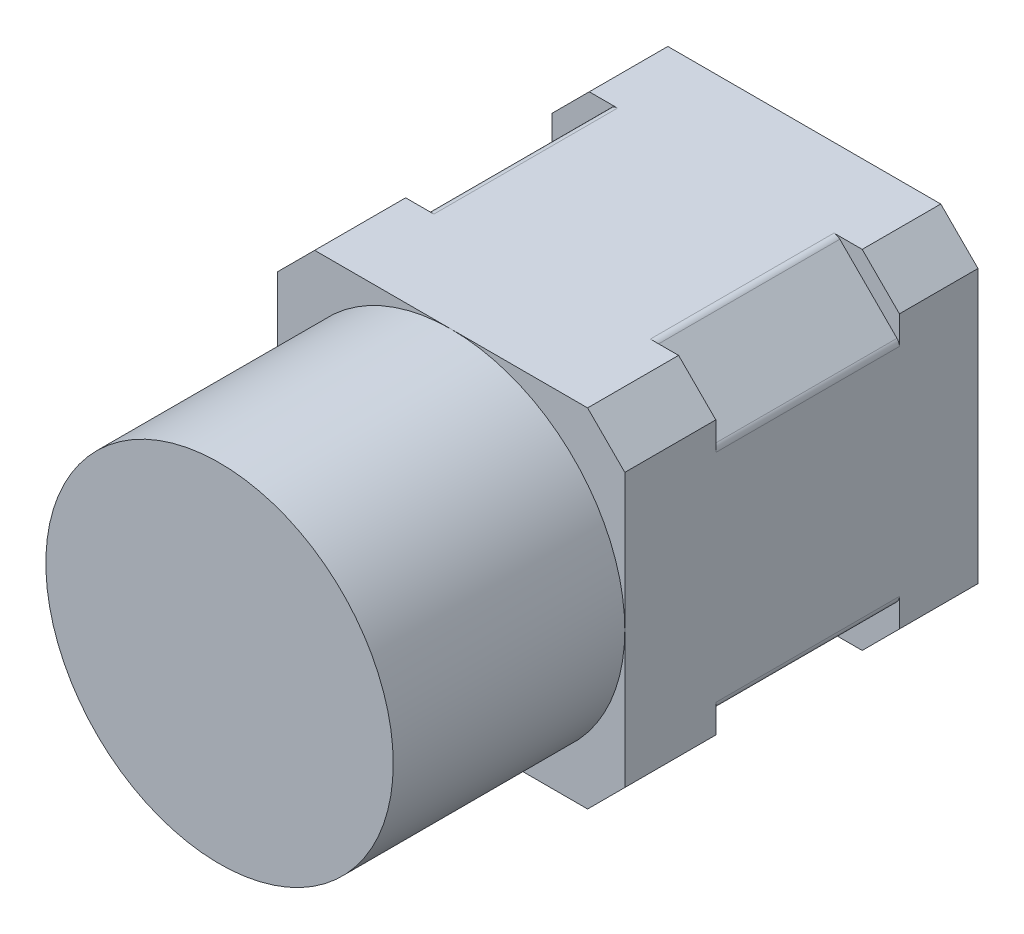
from build123d import *

# Parameters (mm, degrees)
SKETCH1_W           = 42
SKETCH1_H           = 42
BOSS_EXTRUDE1_DEPTH = 9.5
CHAMFER1_SIZE       = 4.5
BOSS_EXTRUDE2_DEPTH = 22.2
FILLET1_R           = 1
BOSS_EXTRUDE3_DEPTH = 11
SKETCH5_R           = 21
BOSS_EXTRUDE4_DEPTH = 28


with BuildPart() as part:
    # Sketch1 → Boss-Extrude1 (new body)
    with BuildSketch(Plane.XY):
        Rectangle(SKETCH1_W, SKETCH1_H)
    extrude(amount=-BOSS_EXTRUDE1_DEPTH)

    # Chamfer1
    chamfer1_edges = [part.edges().sort_by_distance(p)[0] for p in [
        (21, -21, -4.75),
        (-21, -21, -4.75),
        (-21, 21, -4.75),
        (21, 21, -4.75),
    ]]
    chamfer(chamfer1_edges, length=CHAMFER1_SIZE)

    # Sketch3 → Boss-Extrude2 (add)
    with BuildSketch(Plane.XY):
        Polygon((13.5, 21), (-13.5, 21), (-21, 13.5), (-21, -13.5), (-13.5, -21), (13.5, -21), (21, -13.5), (21, 13.5), align=None)
    extrude(amount=BOSS_EXTRUDE2_DEPTH)

    # Fillet1
    fillet1_edges = [part.edges().sort_by_distance(p)[0] for p in [
        (-13.5, 21, 11.1),
        (-21, 13.5, 11.1),
        (-21, -13.5, 11.1),
        (-13.5, -21, 11.1),
        (13.5, -21, 11.1),
        (21, -13.5, 11.1),
        (21, 13.5, 11.1),
        (13.5, 21, 11.1),
    ]]
    fillet(fillet1_edges, radius=FILLET1_R)

    # Sketch4 → Boss-Extrude3 (add)
    with BuildSketch(Plane.XY.offset(22.2)):
        Polygon((-21, 16.5), (-16.5, 21), (16.5, 21), (21, 16.5), (21, -16.5), (16.5, -21), (-16.5, -21), (-21, -16.5), align=None)
    extrude(amount=BOSS_EXTRUDE3_DEPTH)

    # Sketch5 → Boss-Extrude4 (add)
    with BuildSketch(Plane.XY.offset(33.2)):
        Circle(SKETCH5_R)
    extrude(amount=BOSS_EXTRUDE4_DEPTH)


solid = part.part
